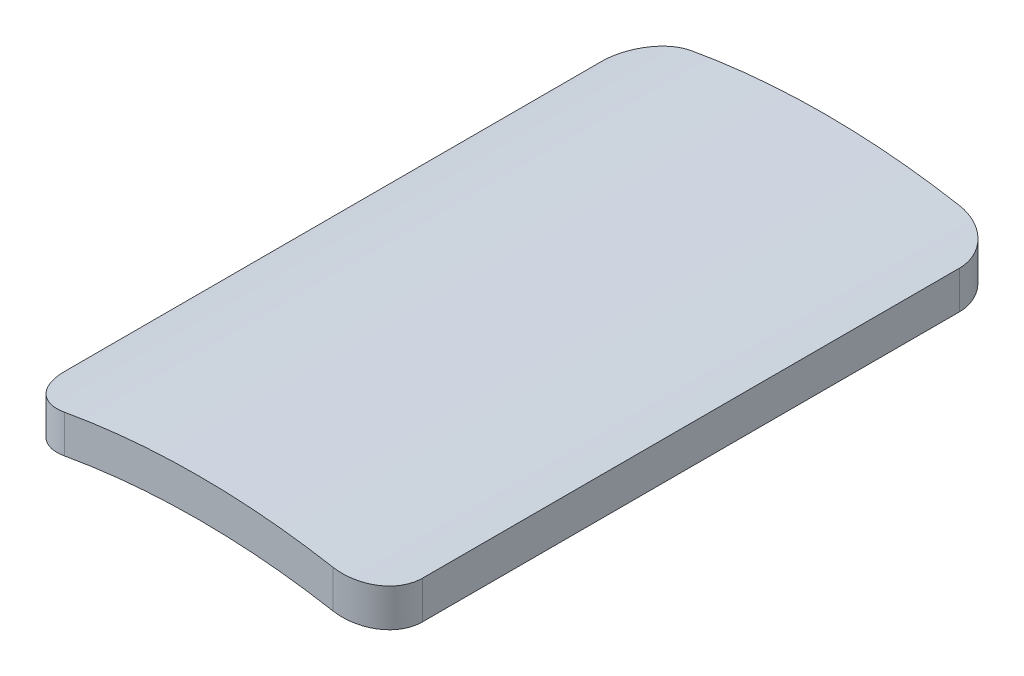
from build123d import *

# Parameters (mm, degrees)
BOSS_EXTRUDE1_DEPTH = 210
FILLET2_R           = 15


with BuildPart() as part:
    # Sketch1 → Boss-Extrude1 (new body)
    with BuildSketch(Plane.XY):
        with BuildLine():
            Line((-60, 259.511669092), (-60, 246.811669092))
            ThreePointArc((-60, 246.811669092), (0, 254), (60, 246.811669092))
            Line((60, 246.811669092), (60, 259.511669092))
            ThreePointArc((60, 259.511669092), (0, 266.7), (-60, 259.511669092))
        make_face()
    extrude(amount=BOSS_EXTRUDE1_DEPTH)

    # Fillet2
    fillet2_edges = [part.edges().sort_by_distance(p)[0] for p in [
        (60, 253.161669092, 210),
        (60, 253.161669092, 0),
        (-60, 253.161669092, 0),
        (-60, 253.161669092, 210),
    ]]
    fillet(fillet2_edges, radius=FILLET2_R)


solid = part.part
